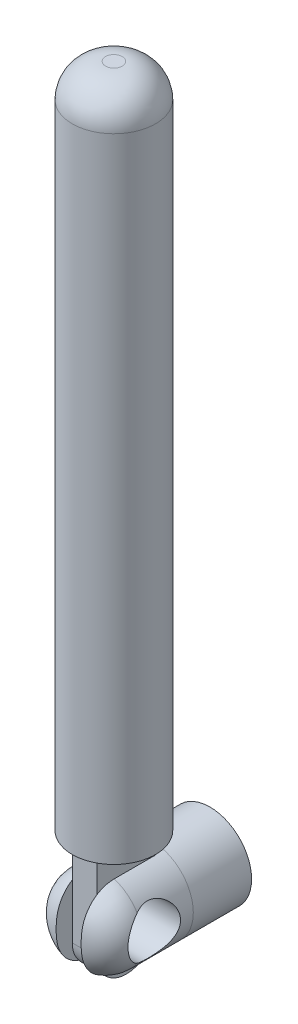
from build123d import *

# Parameters (mm, degrees)
SKETCH_1_R          = 5
EXTRUDE_1_DEPTH     = 7
SKETCH_3_R          = 5
EXTRUDE_3_DEPTH     = 10
FILLET_1_R          = 4
SKETCH_4_W          = 3
SKETCH_4_H          = 11.343584382
CUT_EXTRUDE_5_DEPTH = 9
SKETCH_5_R          = 3
CUT_EXTRUDE_6_DEPTH = 18.5
EXTRUDE_7_DEPTH     = 3
SKETCH_7_R          = 5
EXTRUDE_8_DEPTH     = 80
FILLET_2_R          = 4
SKETCH_8_R          = 3
CUT_EXTRUDE_9_DEPTH = 91.16797782


with BuildPart() as part:
    # Эскиз1 → Вытянуть1 (new body)
    with BuildSketch(Plane.XY):
        Circle(SKETCH_1_R)
    extrude(amount=EXTRUDE_1_DEPTH)


with BuildPart() as body_2:
    # Эскиз3 → Вытянуть3 (new body)
    with BuildSketch(Plane.XY.offset(7)):
        Circle(SKETCH_3_R)
    extrude(amount=EXTRUDE_3_DEPTH)

    # Скругление1
    fillet_1_edges = [body_2.edges().sort_by_distance(p)[0] for p in [
        (-5, 0, 17),
    ]]
    fillet(fillet_1_edges, radius=FILLET_1_R)

    # Эскиз4 → Вытянуть5 (cut)
    with BuildSketch(Plane.XY.offset(17)):
        Rectangle(SKETCH_4_W, SKETCH_4_H)
    extrude(amount=-CUT_EXTRUDE_5_DEPTH, mode=Mode.SUBTRACT)

    # Эскиз5 → Вытянуть6 (cut, symmetric)
    with BuildSketch(Plane(origin=(-1.5, 0, 0), x_dir=(0, 0, -1), z_dir=(1, 0, 0))):
        with Locations(Location((-11.535811132, 0, 0), (0, 0, 119.213344615))):
            Circle(SKETCH_5_R)
    extrude(amount=CUT_EXTRUDE_6_DEPTH, both=True, mode=Mode.SUBTRACT)

    # Эскиз6 → Вытянуть7 (add)
    with BuildSketch(Plane(origin=(-1.5, 0, 0), x_dir=(0, 0, -1), z_dir=(1, 0, 0))):
        with BuildLine():
            Line((-15.035806814, -2.368679074), (-15.035806814, 8.31806101))
            Line((-15.035806814, 8.31806101), (-8.03581545, 8.31806101))
            Line((-8.03581545, 8.31806101), (-8.03581545, -2.357682884))
            ThreePointArc((-8.03581545, -2.357682884), (-11.530313037, -5.86317666), (-15.035806814, -2.368679074))
        make_face()
    extrude(amount=EXTRUDE_7_DEPTH)

    # Эскиз7 → Вытянуть8 (add)
    with BuildSketch(Plane(origin=(0, 8.31806101, 0), x_dir=(-1, 0, 0), z_dir=(0, 1, 0))):
        with Locations((0, 11.535811132)):
            Circle(SKETCH_7_R)
    extrude(amount=EXTRUDE_8_DEPTH)

    # Скругление2
    fillet_2_edges = [body_2.edges().sort_by_distance(p)[0] for p in [
        (5, 88.31806101, 11.535811132),
    ]]
    fillet(fillet_2_edges, radius=FILLET_2_R)

    # Эскиз8 → Вытянуть9 (cut, through all)
    with BuildSketch(Plane(origin=(1.5, 0, 0), x_dir=(0, 0, -1), z_dir=(1, 0, 0))):
        with Locations(Location((-11.535811132, 0, 0), (0, 0, 119.213344615))):
            Circle(SKETCH_8_R)
    extrude(amount=-CUT_EXTRUDE_9_DEPTH, mode=Mode.SUBTRACT)


solid = Compound([part.part, body_2.part])
